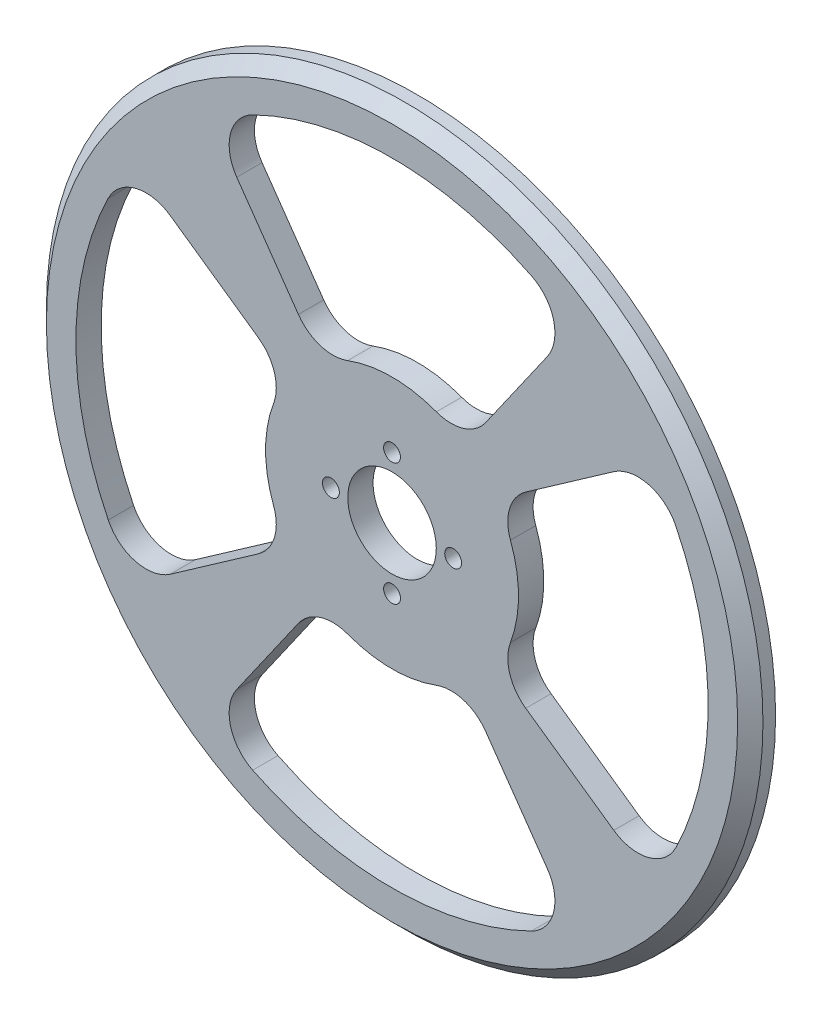
from build123d import *

# Parameters (mm, degrees)
SKETCH_1_R               = 85
SKETCH_1_R_2             = 10.5
EXTRUDE_1_DEPTH          = 6
SKETCH_2_R               = 2
CUT_EXTRUDE_1_DEPTH      = 3
PATTERN_CIRCULAR_2_COUNT = 4
CHAMFER_1_SIZE           = 3


with BuildPart() as part:
    # 草图1 → 凸台-拉伸1 (new body)
    with BuildSketch(Plane.XY):
        Circle(SKETCH_1_R)
        with BuildLine():
            Line((-31.725622255, -22.214519858), (-52.610992631, -36.838613633))
            ThreePointArc((-52.610992631, -36.838613633), (-60.837871991, -38.331841306), (-67.323181147, -33.054338296))
            ThreePointArc((-67.323181147, -33.054338296), (-75, 0), (-67.323181147, 33.054338296))
            ThreePointArc((-67.323181147, 33.054338296), (-60.837871991, 38.331841306), (-52.610992631, 36.838613633))
            Line((-52.610992631, 36.838613633), (-31.725622255, 22.214519858))
            ThreePointArc((-31.725622255, 22.214519858), (-27.910605416, 16.986540946), (-28.096039964, 10.517249561))
            ThreePointArc((-28.096039964, 10.517249561), (-30, 0), (-28.096039964, -10.517249561))
            ThreePointArc((-28.096039964, -10.517249561), (-27.910605416, -16.986540946), (-31.725622255, -22.214519858))
        make_face(mode=Mode.SUBTRACT)
        with BuildLine():
            Line((22.214519858, -31.725622255), (36.838613633, -52.610992631))
            ThreePointArc((36.838613633, -52.610992631), (38.331841306, -60.837871991), (33.054338296, -67.323181147))
            ThreePointArc((33.054338296, -67.323181147), (0, -75), (-33.054338296, -67.323181147))
            ThreePointArc((-33.054338296, -67.323181147), (-38.331841306, -60.837871991), (-36.838613633, -52.610992631))
            Line((-36.838613633, -52.610992631), (-22.214519858, -31.725622255))
            ThreePointArc((-22.214519858, -31.725622255), (-16.986540946, -27.910605416), (-10.517249561, -28.096039964))
            ThreePointArc((-10.517249561, -28.096039964), (0, -30), (10.517249561, -28.096039964))
            ThreePointArc((10.517249561, -28.096039964), (16.986540946, -27.910605416), (22.214519858, -31.725622255))
        make_face(mode=Mode.SUBTRACT)
        with BuildLine():
            Line((36.838613633, 52.610992631), (22.214519858, 31.725622255))
            ThreePointArc((22.214519858, 31.725622255), (16.986540946, 27.910605416), (10.517249561, 28.096039964))
            ThreePointArc((10.517249561, 28.096039964), (0, 30), (-10.517249561, 28.096039964))
            ThreePointArc((-10.517249561, 28.096039964), (-16.986540946, 27.910605416), (-22.214519858, 31.725622255))
            Line((-22.214519858, 31.725622255), (-36.838613633, 52.610992631))
            ThreePointArc((-36.838613633, 52.610992631), (-38.331841306, 60.837871991), (-33.054338296, 67.323181147))
            ThreePointArc((-33.054338296, 67.323181147), (0, 75), (33.054338296, 67.323181147))
            ThreePointArc((33.054338296, 67.323181147), (38.331841306, 60.837871991), (36.838613633, 52.610992631))
        make_face(mode=Mode.SUBTRACT)
        with BuildLine():
            Line((31.725622255, 22.214519858), (52.610992631, 36.838613633))
            ThreePointArc((52.610992631, 36.838613633), (60.837871991, 38.331841306), (67.323181147, 33.054338296))
            ThreePointArc((67.323181147, 33.054338296), (75, 0), (67.323181147, -33.054338296))
            ThreePointArc((67.323181147, -33.054338296), (60.837871991, -38.331841306), (52.610992631, -36.838613633))
            Line((52.610992631, -36.838613633), (31.725622255, -22.214519858))
            ThreePointArc((31.725622255, -22.214519858), (27.910605416, -16.986540946), (28.096039964, -10.517249561))
            ThreePointArc((28.096039964, -10.517249561), (30, 0), (28.096039964, 10.517249561))
            ThreePointArc((28.096039964, 10.517249561), (27.910605416, 16.986540946), (31.725622255, 22.214519858))
        make_face(mode=Mode.SUBTRACT)
        Circle(SKETCH_1_R_2, mode=Mode.SUBTRACT)
    extrude(amount=EXTRUDE_1_DEPTH)

    # 草图2 → 切除-拉伸1 (cut)
    with BuildSketch(Plane.XY.offset(6)):
        with Locations((0, 14.5)):
            Circle(SKETCH_2_R)
    cut_extrude_1 = extrude(amount=-CUT_EXTRUDE_1_DEPTH, mode=Mode.SUBTRACT)

    # 阵列(圆周)2: 切除-拉伸1 ×4 about axis
    pattern_circular_2_axis = Axis((0, 0, 0), (0, 0, 1))
    for i in range(1, PATTERN_CIRCULAR_2_COUNT):
        add(cut_extrude_1.rotate(pattern_circular_2_axis, i * 360 / PATTERN_CIRCULAR_2_COUNT), mode=Mode.SUBTRACT)

    # 倒角1
    chamfer_1_edges = [part.edges().sort_by_distance(p)[0] for p in [
        (-85, 0, 6),
    ]]
    chamfer(chamfer_1_edges, length=CHAMFER_1_SIZE)


solid = part.part
